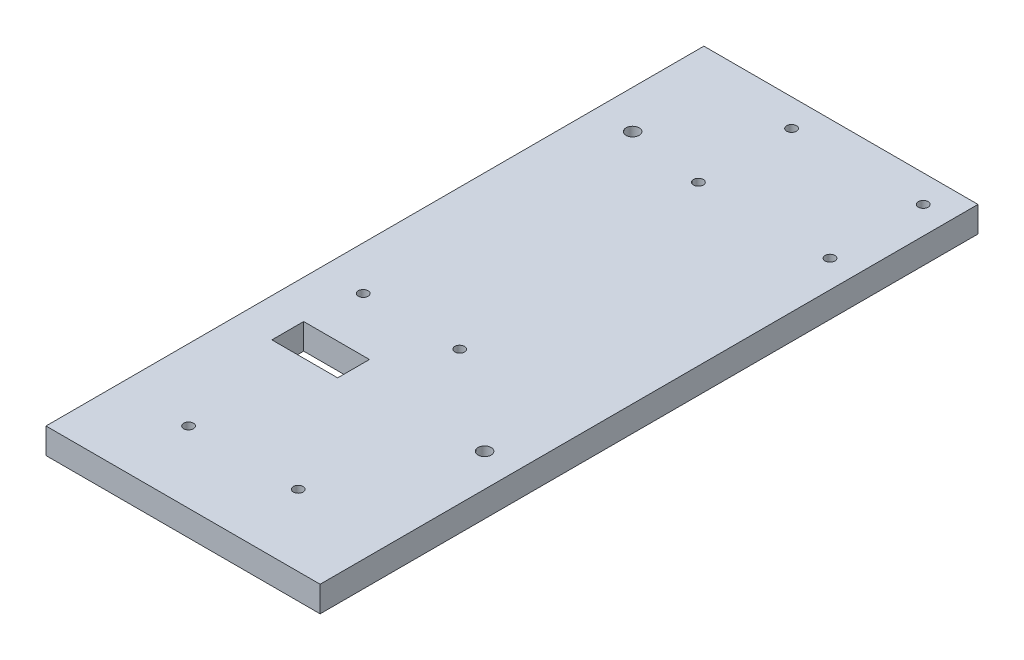
from build123d import *

# Parameters (mm, degrees)
SKETCH1_W             = 63.5
SKETCH1_H             = 152.4
BOSS_EXTRUDE1_DEPTH   = 5.9436
SKETCH4_W             = 15.24
SKETCH4_H             = 7.366
CUT_EXTRUDE3_DEPTH    = 166.206950159
F_4_40_TAPPED_HOLE1_D = 2.2606
F_4_40_TAPPED_HOLE2_D = 2.2606
F_4_40_TAPPED_HOLE3_D = 2.2606
SKETCH13_R            = 1.524
CUT_EXTRUDE5_DEPTH    = 166.206950159


with BuildPart() as part:
    # Sketch1 → Boss-Extrude1 (new body)
    with BuildSketch(Plane(origin=(0, 0, 0), x_dir=(1, 0, 0), z_dir=(0, 1, 0))):
        with Locations((31.75, 76.2)):
            Rectangle(SKETCH1_W, SKETCH1_H)
    extrude(amount=BOSS_EXTRUDE1_DEPTH)

    # Sketch4 → Cut-Extrude3 (cut, through all)
    with BuildSketch(Plane(origin=(0, 5.9436, 0), x_dir=(1, 0, 0), z_dir=(0, 1, 0))):
        with Locations((16.51, 47.117)):
            Rectangle(SKETCH4_W, SKETCH4_H)
    extrude(amount=-CUT_EXTRUDE3_DEPTH, mode=Mode.SUBTRACT)

    # #4-40 Tapped Hole1 (through all)
    with Locations(Plane(origin=(0, 5.9436, 0), x_dir=(1, 0, 0), z_dir=(0, 1, 0))):
        with Locations((57.15, 146.05), (57.15, 124.46), (26.67, 124.46), (26.67, 146.05)):
            Hole(F_4_40_TAPPED_HOLE1_D / 2)

    # #4-40 Tapped Hole2 (through all)
    with Locations(Plane(origin=(0, 5.9436, 0), x_dir=(1, 0, 0), z_dir=(0, 1, 0))):
        with Locations((32.512, 63.3222), (10.16, 63.3222)):
            Hole(F_4_40_TAPPED_HOLE2_D / 2)

    # #4-40 Tapped Hole3 (through all)
    with Locations(Plane(origin=(0, 5.9436, 0), x_dir=(1, 0, 0), z_dir=(0, 1, 0))):
        with Locations((41.91, 16.51), (16.51, 16.51)):
            Hole(F_4_40_TAPPED_HOLE3_D / 2)

    # Sketch13 → Cut-Extrude5 (cut, through all)
    with BuildSketch(Plane(origin=(0, 5.9436, 0), x_dir=(1, 0, 0), z_dir=(0, 1, 0))):
        with Locations(Location((8.89, 127, 0), (0, 0, 270))):
            Circle(SKETCH13_R)
        with Locations(Location((55.88, 45.72, 0), (0, 0, 270))):
            Circle(SKETCH13_R)
    extrude(amount=-CUT_EXTRUDE5_DEPTH, mode=Mode.SUBTRACT)


solid = part.part
